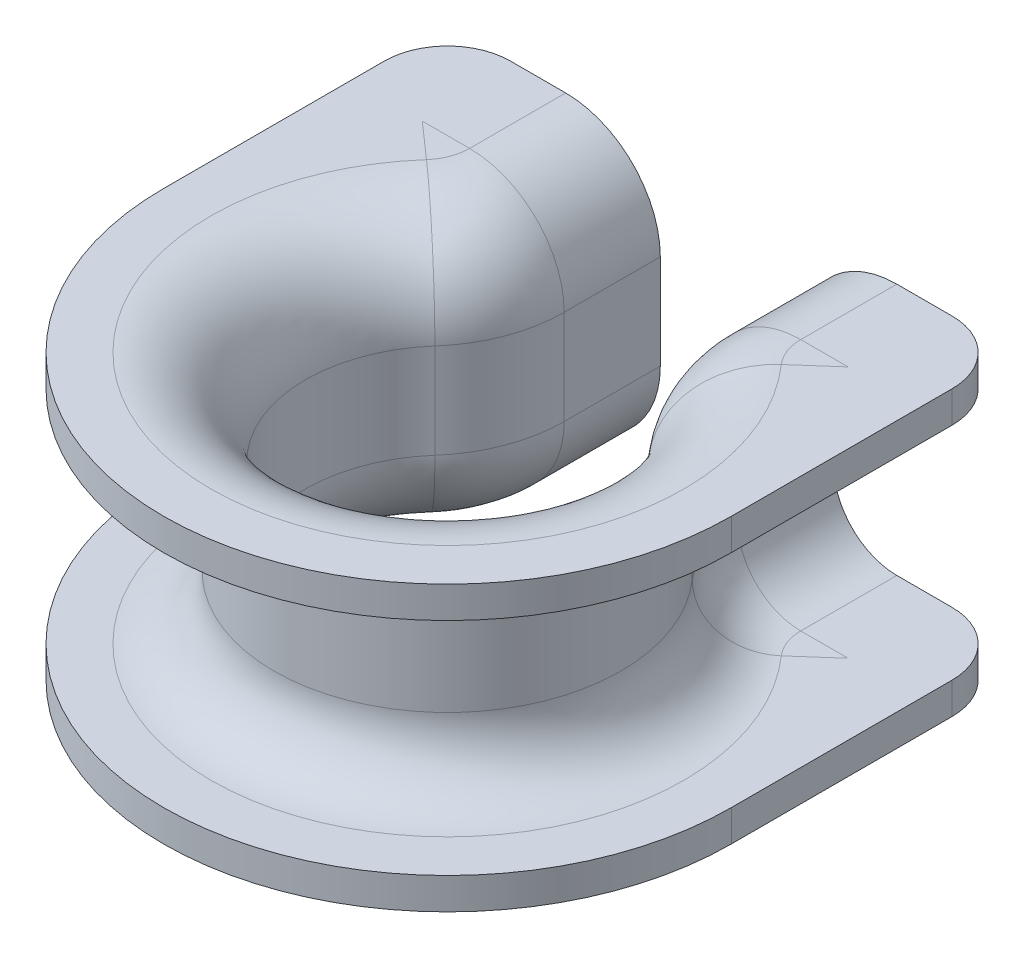
from build123d import *

# Parameters (mm, degrees)
BOSS_EXTRUDE1_REACH      = 43.243
BOSS_EXTRUDE1_END_RADIUS = 18
SKETCH7_W                = 4.5
SKETCH7_H                = 2
FILLET1_R                = 4


with BuildPart() as part:
    # Sweep1: sweep along a path in Sketch6
    with BuildLine(Plane(origin=(0, 0, 0), x_dir=(1, 0, 0), z_dir=(0, 1, 0))) as sweep1_path:
        Line((-4.5, 18), (-4.5, 11.9058809))
        ThreePointArc((-4.5, 11.9058809), (-5.08127088, 8.723900384), (-6.75, 5.95294045))
        ThreePointArc((-6.75, 5.95294045), (0, -9), (6.75, 5.95294045))
        ThreePointArc((6.75, 5.95294045), (5.08127088, 8.723900384), (4.5, 11.9058809))
        Line((4.5, 11.9058809), (4.5, 18))
    # Sketch3 → Sweep1 (sweep)
    with BuildSketch(Plane(origin=(0, 0, 0), x_dir=(0, 0, -1), z_dir=(1, 0, 0))):
        with BuildLine():
            Line((-9, -3), (-9, 3))
            ThreePointArc((-9, 3), (-10.757359313, 7.242640687), (-15, 9))
            Line((-15, 9), (-18, 9))
            Line((-18, 9), (-18, 7))
            Line((-18, 7), (-15, 7))
            ThreePointArc((-15, 7), (-12.171572875, 5.828427125), (-11, 3))
            Line((-11, 3), (-11, -3))
            ThreePointArc((-11, -3), (-12.171572875, -5.828427125), (-15, -7))
            Line((-15, -7), (-18, -7))
            Line((-18, -7), (-18, -9))
            Line((-18, -9), (-15, -9))
            ThreePointArc((-15, -9), (-10.757359313, -7.242640687), (-9, -3))
        make_face()
    sweep(path=sweep1_path.line)

    # Boss-Extrude1: up to this cylinder (the profile starts outside it)
    boss_extrude1_end = Plane(origin=(0, 0, 0), z_dir=(0, -1, 0)) * Cylinder(BOSS_EXTRUDE1_END_RADIUS, 139.486, mode=Mode.PRIVATE)
    # Sketch7 → Boss-Extrude1 (add, up to the surface)
    with BuildSketch(Plane(origin=(0, 0, -18), x_dir=(-1, 0, 0), z_dir=(0, 0, -1)), mode=Mode.PRIVATE) as boss_extrude1_sk1:
        with Locations((15.75, -8)):
            Rectangle(SKETCH7_W, SKETCH7_H)
    boss_extrude1_tool1 = extrude(boss_extrude1_sk1.sketch, amount=-BOSS_EXTRUDE1_REACH, mode=Mode.PRIVATE) - boss_extrude1_end
    add(boss_extrude1_tool1.solids().sort_by_distance((-15.75, -8, -18))[0])
    # Sketch7 → Boss-Extrude1 (add, up to the surface)
    with BuildSketch(Plane(origin=(0, 0, -18), x_dir=(-1, 0, 0), z_dir=(0, 0, -1)), mode=Mode.PRIVATE) as boss_extrude1_sk2:
        with Locations((15.75, 8)):
            Rectangle(SKETCH7_W, SKETCH7_H)
    boss_extrude1_tool2 = extrude(boss_extrude1_sk2.sketch, amount=-BOSS_EXTRUDE1_REACH, mode=Mode.PRIVATE) - boss_extrude1_end
    add(boss_extrude1_tool2.solids().sort_by_distance((-15.75, 8, -18))[0])
    # Sketch7 → Boss-Extrude1 (add, up to the surface)
    with BuildSketch(Plane(origin=(0, 0, -18), x_dir=(-1, 0, 0), z_dir=(0, 0, -1)), mode=Mode.PRIVATE) as boss_extrude1_sk3:
        with Locations((-15.75, 8)):
            Rectangle(SKETCH7_W, SKETCH7_H)
    boss_extrude1_tool3 = extrude(boss_extrude1_sk3.sketch, amount=-BOSS_EXTRUDE1_REACH, mode=Mode.PRIVATE) - boss_extrude1_end
    add(boss_extrude1_tool3.solids().sort_by_distance((15.75, 8, -18))[0])
    # Sketch7 → Boss-Extrude1 (add, up to the surface)
    with BuildSketch(Plane(origin=(0, 0, -18), x_dir=(-1, 0, 0), z_dir=(0, 0, -1)), mode=Mode.PRIVATE) as boss_extrude1_sk4:
        with Locations((-15.75, -8)):
            Rectangle(SKETCH7_W, SKETCH7_H)
    boss_extrude1_tool4 = extrude(boss_extrude1_sk4.sketch, amount=-BOSS_EXTRUDE1_REACH, mode=Mode.PRIVATE) - boss_extrude1_end
    add(boss_extrude1_tool4.solids().sort_by_distance((15.75, -8, -18))[0])

    # Fillet1
    fillet1_edges = [part.edges().sort_by_distance(p)[0] for p in [
        (-18, -8, -18),
        (-18, 8, -18),
        (18, 8, -18),
        (18, -8, -18),
    ]]
    fillet(fillet1_edges, radius=FILLET1_R)


solid = part.part
